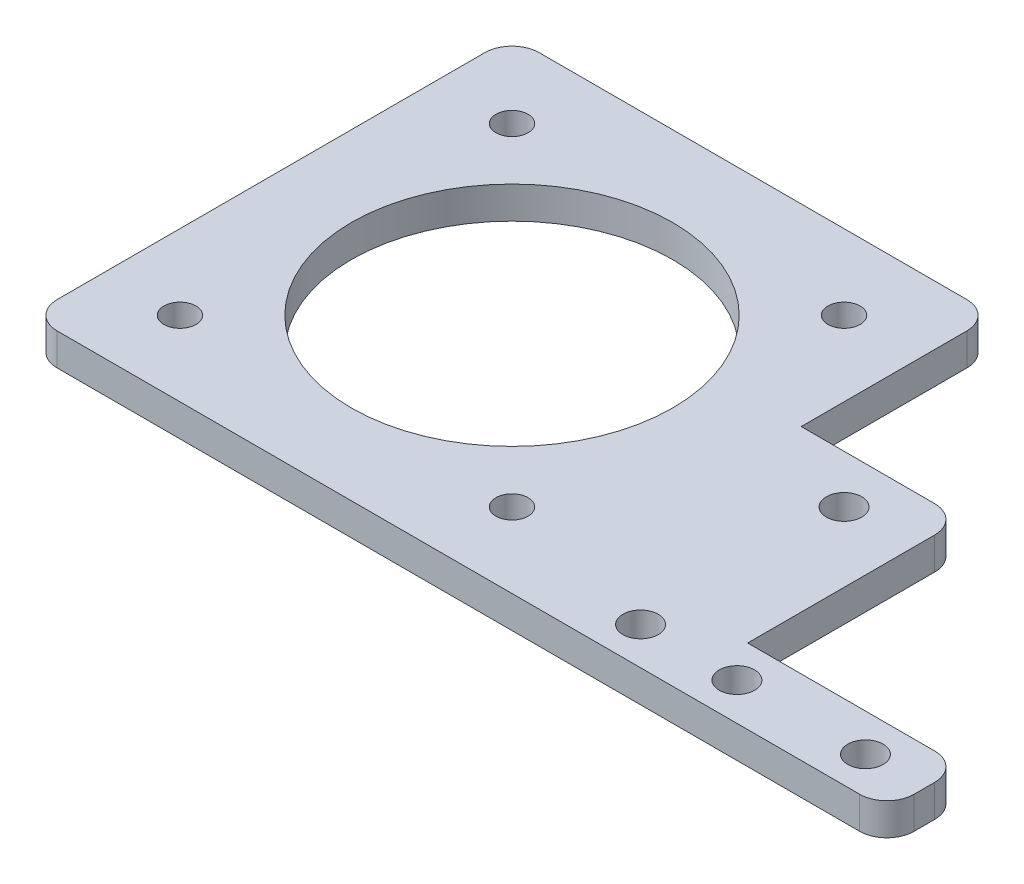
from build123d import *

# Parameters (mm, degrees)
SKETCH1_R       = 15
SKETCH1_R_2     = 1.5
SKETCH1_R_3     = 1.65
MAIN_BODY_DEPTH = 3
FILLET_2_R      = 2.54


with BuildPart() as part:
    # Sketch1 → Main Body (new body)
    with BuildSketch(Plane(origin=(0, 0, 0), x_dir=(1, 0, 0), z_dir=(0, 1, 0))):
        Polygon((22.5, -22.5), (57.5, -22.5), (57.5, -15.5), (37.5, -15.5), (37.5, 4.5), (22.5, 4.5), (22.5, 22.5), (-22.5, 22.5), (-22.5, -22.5), align=None)
        with Locations(Location((0, 0, 0), (0, 0, 270))):
            Circle(SKETCH1_R, mode=Mode.SUBTRACT)
        with Locations(Location((15.5, 15.5, 0), (0, 0, 270))):
            Circle(SKETCH1_R_2, mode=Mode.SUBTRACT)
        with Locations(Location((15.5, -15.5, 0), (0, 0, 270))):
            Circle(SKETCH1_R_2, mode=Mode.SUBTRACT)
        with Locations(Location((-15.5, -15.5, 0), (0, 0, 270))):
            Circle(SKETCH1_R_2, mode=Mode.SUBTRACT)
        with Locations(Location((-15.5, 15.5, 0), (0, 0, 270))):
            Circle(SKETCH1_R_2, mode=Mode.SUBTRACT)
        with Locations(Location((31, 0, 0), (0, 0, 270))):
            Circle(SKETCH1_R_3, mode=Mode.SUBTRACT)
        with Locations(Location((31, -19, 0), (0, 0, 270))):
            Circle(SKETCH1_R_3, mode=Mode.SUBTRACT)
        with Locations(Location((40, -19, 0), (0, 0, 270))):
            Circle(SKETCH1_R_3, mode=Mode.SUBTRACT)
        with Locations(Location((52, -19, 0), (0, 0, 270))):
            Circle(SKETCH1_R_3, mode=Mode.SUBTRACT)
    extrude(amount=MAIN_BODY_DEPTH)

    # FIllet 2
    fillet_2_edges = [part.edges().sort_by_distance(p)[0] for p in [
        (37.5, 1.5, -4.5),
        (57.5, 1.5, 15.5),
        (57.5, 1.5, 22.5),
        (-22.5, 1.5, 22.5),
        (-22.5, 1.5, -22.5),
        (22.5, 1.5, -22.5),
    ]]
    fillet(fillet_2_edges, radius=FILLET_2_R)


solid = part.part
